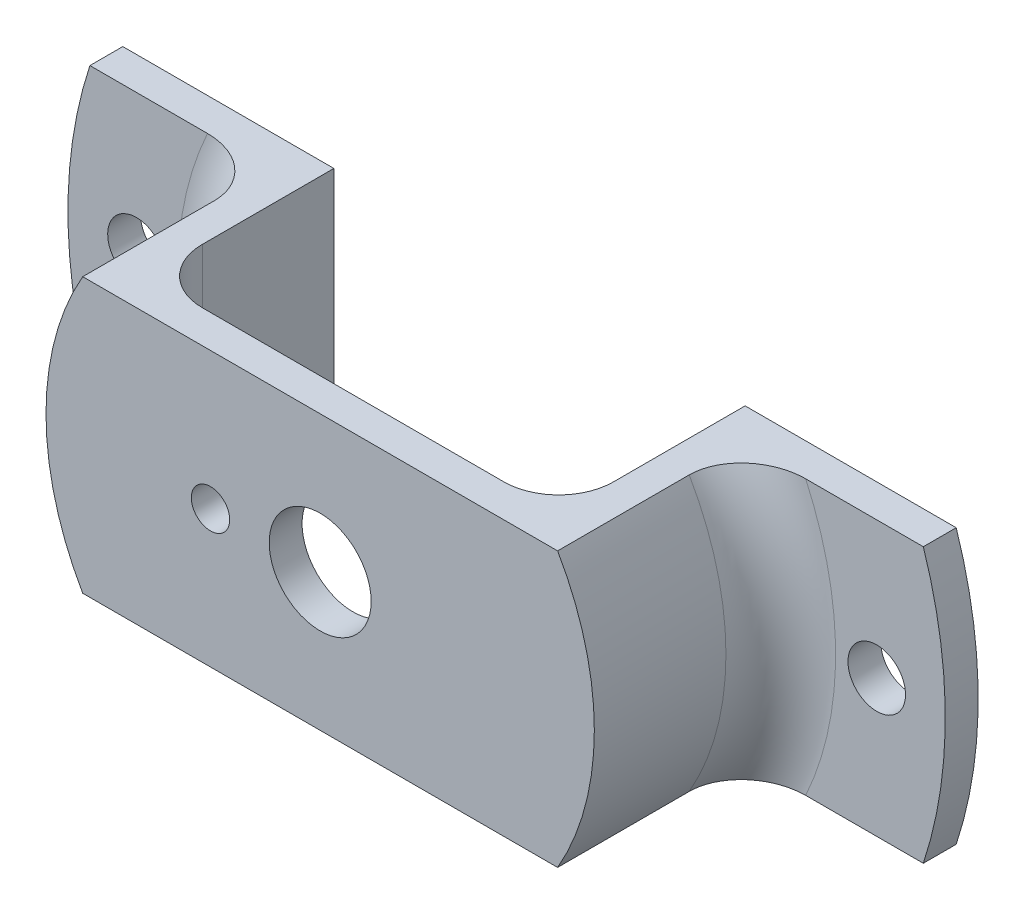
from build123d import *

# Parameters (mm, degrees)
SKETCH1_W           = 57.5
SKETCH1_H           = 25
SKETCH1_R           = 4.65
SKETCH1_R_2         = 1.75
BOSS_EXTRUDE1_DEPTH = 3
SKETCH2_W           = 10
SKETCH2_H           = 25
BOSS_EXTRUDE2_DEPTH = 17
SKETCH4_W           = 3
SKETCH4_H           = 25
BOSS_EXTRUDE3_DEPTH = 15
SKETCH8_R           = 69.668681809
SKETCH8_R_2         = 40
CUT_EXTRUDE3_DEPTH  = 40
SKETCH9_R           = 2.625
CUT_EXTRUDE4_DEPTH  = 5
SKETCH11_R          = 34.641133141
SKETCH11_R_2        = 25
CUT_EXTRUDE5_DEPTH  = 17
FILLET1_R           = 5


with BuildPart() as part:
    # Sketch1 → Boss-Extrude1 (new body)
    with BuildSketch(Plane.XY):
        Rectangle(SKETCH1_W, SKETCH1_H)
        Circle(SKETCH1_R, mode=Mode.SUBTRACT)
        with Locations((-10, 0)):
            Circle(SKETCH1_R_2, mode=Mode.SUBTRACT)
    extrude(amount=BOSS_EXTRUDE1_DEPTH)

    # Sketch2 → Boss-Extrude2 (add)
    with BuildSketch(Plane(origin=(0, 0, 0), x_dir=(-1, 0, 0), z_dir=(0, 0, -1))):
        with Locations((-23.75, 0)):
            Rectangle(SKETCH2_W, SKETCH2_H)
    boss_extrude2 = extrude(amount=BOSS_EXTRUDE2_DEPTH)

    # Sketch4 → Boss-Extrude3 (add)
    with BuildSketch(Plane(origin=(28.75, 0, 0), x_dir=(0, 0, -1), z_dir=(1, 0, 0))):
        with Locations((15.5, 0)):
            Rectangle(SKETCH4_W, SKETCH4_H)
    boss_extrude3 = extrude(amount=BOSS_EXTRUDE3_DEPTH)

    # Mirror2: Boss-Extrude2 across plane
    add(boss_extrude2.mirror(Plane(origin=(0, 0, 0), x_dir=(0, 0, 1), z_dir=(1, 0, 0))))

    # Mirror3: Boss-Extrude3 across plane
    add(boss_extrude3.mirror(Plane(origin=(0, 0, 0), x_dir=(0, 0, 1), z_dir=(1, 0, 0))))

    # Sketch8 → Cut-Extrude3 (cut)
    with BuildSketch(Plane(origin=(0, 0, -17), x_dir=(-1, 0, 0), z_dir=(0, 0, -1))):
        Circle(SKETCH8_R)
        Circle(SKETCH8_R_2, mode=Mode.SUBTRACT)
    extrude(amount=-CUT_EXTRUDE3_DEPTH, mode=Mode.SUBTRACT)

    # Sketch9 → Cut-Extrude4 (cut, symmetric)
    with BuildSketch(Plane.XY.offset(-14)):
        with Locations(Location((-33.75, 0, 0), (0, 0, 270))):
            Circle(SKETCH9_R)
        with Locations(Location((33.75, 0, 0), (0, 0, 90))):
            Circle(SKETCH9_R)
    extrude(amount=CUT_EXTRUDE4_DEPTH, both=True, mode=Mode.SUBTRACT)

    # Sketch11 → Cut-Extrude5 (cut)
    with BuildSketch(Plane.XY.offset(3)):
        Circle(SKETCH11_R)
        Circle(SKETCH11_R_2, mode=Mode.SUBTRACT)
    extrude(amount=-CUT_EXTRUDE5_DEPTH, mode=Mode.SUBTRACT)

    # Fillet1
    fillet1_edges = [part.edges().sort_by_distance(p)[0] for p in [
        (-25, 0, -14),
        (25, 0, -14),
        (18.75, 0, 0),
        (-18.75, 0, 0),
    ]]
    fillet(fillet1_edges, radius=FILLET1_R)


solid = part.part
